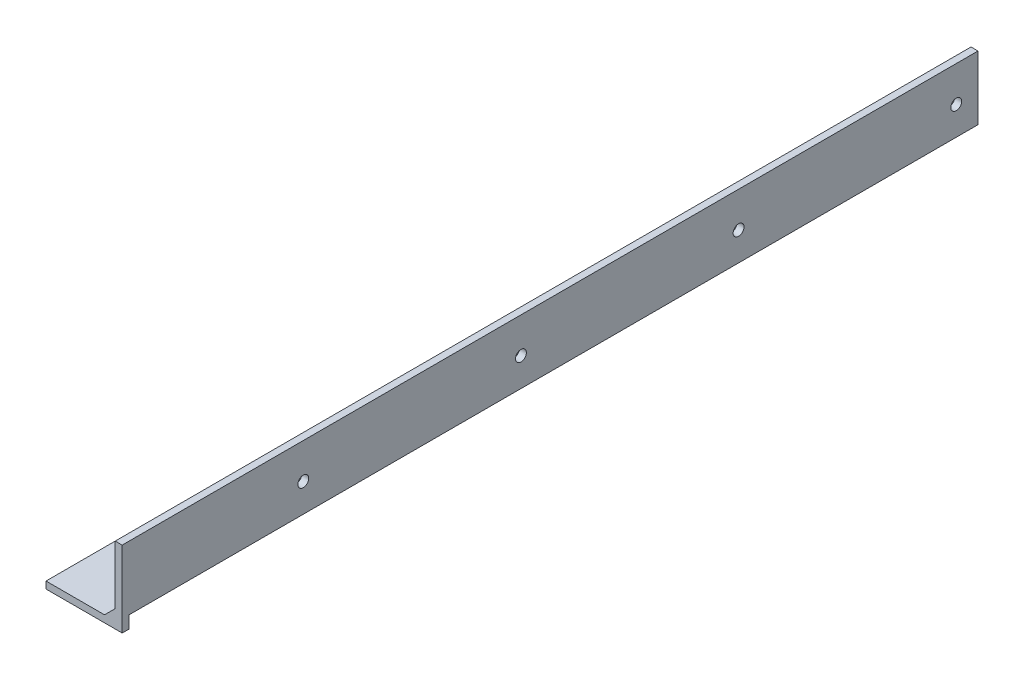
from build123d import *

# Parameters (mm, degrees)
BOSS_EXTRUDE1_DEPTH        = 247.65
F_1_8_0_1250_DOWEL_HOLE1_D = 3.175
F_1_8_0_1250_DOWEL_HOLE2_D = 3.175
BOSS_EXTRUDE2_DEPTH        = 2.032
CUT_EXTRUDE1_DEPTH         = 0.254
SKETCH10_W                 = 1.221153846
SKETCH10_H                 = 1.221153846
SKETCH10_W_2               = 6.35
CUT_EXTRUDE2_DEPTH         = 0.254


with BuildPart() as part:
    # Sketch1 → Boss-Extrude1 (new body)
    with BuildSketch(Plane.XY):
        Polygon((0, 3.592102448), (-3.592102448, 0), (-22.225, 0), (-22.225, 2.032), (-5.152204897, 2.032), (-2.032, 5.152204897), (-2.032, 22.225), (0, 22.225), align=None)
    extrude(amount=BOSS_EXTRUDE1_DEPTH)

    # 1/8 (0.1250) Dowel Hole1 (through all)
    with Locations(Plane.ZY.offset(2.032)):
        with Locations((196.85, 11.90625), (69.85, 11.90625), (133.35, 11.90625), (6.35, 11.90625)):
            Hole(F_1_8_0_1250_DOWEL_HOLE1_D / 2)

    # 1/8 (0.1250) Dowel Hole2 (through all)
    with Locations(Plane(origin=(0, 2.032, 0), x_dir=(1, 0, 0), z_dir=(0, 1, 0))):
        with Locations((-11.90625, -225.425), (-11.90625, -48.8188)):
            Hole(F_1_8_0_1250_DOWEL_HOLE2_D / 2)

    # Sketch6 → Boss-Extrude2 (add)
    with BuildSketch(Plane.XY.offset(247.65)):
        Polygon((-22.225, 0), (0, 0), (0, 22.225), (-2.032, 22.225), (-2.032, 5.152204897), (-5.152204897, 2.032), (-22.225, 2.032), align=None)
    extrude(amount=BOSS_EXTRUDE2_DEPTH)

    # Sketch7 → Cut-Extrude1 (cut)
    # profile 1 of 3: a face of its own
    with BuildSketch(Plane.ZY.offset(2.032)):
        Polygon((235.107067891, 9.543693468), (233.553149621, 9.543693468), (232.91051741, 11.302155006), (229.985853948, 11.302155006), (229.343221737, 9.543693468), (227.780144814, 9.543693468), (230.660541448, 17.163693468), (232.212933275, 17.163693468), align=None)
        Polygon((232.444952506, 12.572155006), (231.443606352, 15.307539622), (230.445313083, 12.572155006), align=None, mode=Mode.SUBTRACT)
    # profile 2 of 3: a face of its own
    with BuildSketch(Plane.ZY.offset(2.032)):
        Polygon((235.888606352, 9.543693468), (235.888606352, 17.163693468), (241.06629866, 17.163693468), (241.06629866, 15.893693468), (237.353990968, 15.893693468), (237.353990968, 14.037539622), (240.577837121, 14.037539622), (240.577837121, 12.767539622), (237.353990968, 12.767539622), (237.353990968, 9.543693468), align=None)
    # profile 3 of 3: a face of its own
    with BuildSketch(Plane.ZY.offset(2.032)):
        Polygon((244.094760198, 9.543693468), (244.094760198, 15.893693468), (241.847837121, 15.893693468), (241.847837121, 17.163693468), (247.807067891, 17.163693468), (247.807067891, 15.893693468), (245.560144814, 15.893693468), (245.560144814, 9.543693468), align=None)
    extrude(amount=-CUT_EXTRUDE1_DEPTH, mode=Mode.SUBTRACT)

    # Sketch10 → Cut-Extrude2 (cut)
    # profile 1 of 14: a face of its own
    with BuildSketch(Plane(origin=(0, 2.032, 0), x_dir=(1, 0, 0), z_dir=(0, 1, 0))):
        with BuildLine():
            Line((-22.225, -162.452538462), (-22.225, -161.231384615))
            Line((-22.225, -161.231384615), (-17.704186699, -161.231384615))
            add(Edge.make_bspline(
                [(-17.704186699, -161.231384615), (-17.760467017, -161.176113693), (-17.872490522, -161.066099347), (-18.026810892, -160.889326477), (-18.173015701, -160.708152688), (-18.304980132, -160.517277309), (-18.427828761, -160.320380437), (-18.537607096, -160.11492728), (-18.639868587, -159.904100466), (-18.696120115, -159.757955871), (-18.724358974, -159.684589744)],
                knots=[0, 0, 0, 0, 1.012608143, 2.015552075, 3.011331447, 4.000718745, 4.993456561, 5.989905615, 6.990911433, 8, 8, 8, 8], degree=3))
            Line((-18.724358974, -159.684589744), (-17.503205128, -159.684589744))
            add(Edge.make_bspline(
                [(-17.503205128, -159.684589744), (-17.472723103, -159.76592176), (-17.408926595, -159.936143344), (-17.272808222, -160.187509922), (-17.105370999, -160.450463464), (-16.940873501, -160.671089125), (-16.793259426, -160.84461008), (-16.675918268, -160.966795698), (-16.555215028, -161.079977408), (-16.427863096, -161.179994792), (-16.296338475, -161.269388031), (-16.160881812, -161.348598491), (-16.021058486, -161.418320822), (-15.923688863, -161.454820137), (-15.875, -161.473071314)],
                knots=[0, 0, 0, 0, 1.253621181, 2.623731602, 4.119264342, 5.756158754, 6.594718004, 7.409281336, 8.202581069, 8.983291728, 9.746205797, 10.498494251, 11.24918464, 12, 12, 12, 12], degree=3))
            Line((-15.875, -161.473071314), (-15.875, -162.452538462))
            Line((-15.875, -162.452538462), (-22.225, -162.452538462))
        make_face()
    # profile 2 of 14: a face of its own
    with BuildSketch(Plane(origin=(0, 2.032, 0), x_dir=(1, 0, 0), z_dir=(0, 1, 0))):
        with BuildLine():
            add(Edge.make_bspline(
                [(-18.772696314, -155.554291266), (-18.756229781, -155.51548151), (-18.723907996, -155.439302717), (-18.668025497, -155.331182341), (-18.606570465, -155.231708656), (-18.54156222, -155.139960121), (-18.473264366, -155.054873627), (-18.3979216, -154.980249153), (-18.318594746, -154.913689877), (-18.208571988, -154.835763139), (-18.062085357, -154.757192646), (-17.877170609, -154.687076), (-17.682722089, -154.645271262), (-17.550045494, -154.639882791), (-17.482852564, -154.637153846)],
                knots=[0, 0, 0, 0, 0.898362958, 1.763376344, 2.591090909, 3.388499105, 4.159186617, 4.913268308, 5.644585397, 6.364250201, 7.783723276, 9.173628931, 10.568608482, 12, 12, 12, 12], degree=3))
            add(Edge.make_bspline(
                [(-17.482852564, -154.637153846), (-17.425963476, -154.638595105), (-17.314252817, -154.641425244), (-17.150377774, -154.664461767), (-16.994122459, -154.704455906), (-16.845012656, -154.758735467), (-16.703963474, -154.829481864), (-16.570444775, -154.915566722), (-16.444558266, -155.017395028), (-16.327568202, -155.134851619), (-16.22063959, -155.265503915), (-16.126659362, -155.410109388), (-16.050308789, -155.569047714), (-15.983710126, -155.739433321), (-15.935708618, -155.924068606), (-15.899429889, -156.121252773), (-15.879848899, -156.331535255), (-15.876645522, -156.476056612), (-15.875, -156.550294872)],
                knots=[0, 0, 0, 0, 0.969511701, 1.903788506, 2.813616835, 3.714588001, 4.603504618, 5.497695013, 6.417687424, 7.358095086, 8.318756073, 9.291119523, 10.28995948, 11.319525871, 12.404821578, 13.536170001, 14.734370785, 16, 16, 16, 16], degree=3))
            add(Edge.make_bspline(
                [(-15.875, -156.550294872), (-15.876611492, -156.624114508), (-15.879738955, -156.767378103), (-15.899734047, -156.976320352), (-15.935226579, -157.171991444), (-15.9844813, -157.355827212), (-16.049959539, -157.526153397), (-16.126661824, -157.685408367), (-16.220974195, -157.830158965), (-16.327578267, -157.961822705), (-16.444096973, -158.080730741), (-16.570890691, -158.182233934), (-16.703538559, -158.270068551), (-16.845075716, -158.340463431), (-16.994090006, -158.394999861), (-17.150503903, -158.434429784), (-17.314127192, -158.459605396), (-17.425941566, -158.462143871), (-17.482852564, -158.463435897)],
                knots=[0, 0, 0, 0, 1.259437241, 2.444221022, 3.576496957, 4.648717845, 5.68588583, 6.685544666, 7.658705287, 8.625770615, 9.572078176, 10.492824823, 11.391686538, 12.281331915, 13.183041723, 14.093615956, 15.029693465, 16, 16, 16, 16], degree=3))
            add(Edge.make_bspline(
                [(-17.482852564, -158.463435897), (-17.553510095, -158.460650015), (-17.692550194, -158.455167946), (-17.894155951, -158.407354714), (-18.084578142, -158.332104896), (-18.25972055, -158.224038206), (-18.420120318, -158.090249134), (-18.559076521, -157.928593287), (-18.680748525, -157.744384264), (-18.741545031, -157.607521039), (-18.772696314, -157.537394231)],
                knots=[0, 0, 0, 0, 1.001685467, 1.971119642, 2.924446479, 3.896772127, 4.879289176, 5.877460772, 6.912440485, 8, 8, 8, 8], degree=3))
            add(Edge.make_bspline(
                [(-18.772696314, -157.537394231), (-18.790724634, -157.580927649), (-18.826100769, -157.666351255), (-18.889093703, -157.787720016), (-18.957982603, -157.900848523), (-19.031604253, -158.00757414), (-19.112972877, -158.105011373), (-19.200025897, -158.194376078), (-19.291985695, -158.276959664), (-19.390877734, -158.349729861), (-19.494230982, -158.415565933), (-19.6026342, -158.470470878), (-19.713503015, -158.520484549), (-19.829601245, -158.557218508), (-19.948645174, -158.588977636), (-20.072194643, -158.609508517), (-20.199536225, -158.62486496), (-20.285945212, -158.625788903), (-20.329667468, -158.62625641)],
                knots=[0, 0, 0, 0, 1.114377326, 2.186690884, 3.231000372, 4.246781561, 5.25120509, 6.230208897, 7.196590548, 8.171680384, 9.131898358, 10.092063928, 11.044441968, 12.005655067, 12.969168724, 13.957075074, 14.966296355, 16, 16, 16, 16], degree=3))
            add(Edge.make_bspline(
                [(-20.329667468, -158.62625641), (-20.400965586, -158.624444591), (-20.541056555, -158.620884615), (-20.74619236, -158.595929584), (-20.940647392, -158.550806914), (-21.12502405, -158.489406493), (-21.300029791, -158.412348612), (-21.464021084, -158.315898041), (-21.617504086, -158.202004347), (-21.759213797, -158.071301385), (-21.88807759, -157.92639951), (-22.000070379, -157.768451731), (-22.094740267, -157.599012053), (-22.17323724, -157.418595599), (-22.232079868, -157.225893977), (-22.275901998, -157.022165), (-22.301139434, -156.8070329), (-22.304630003, -156.659754499), (-22.306410256, -156.584639824)],
                knots=[0, 0, 0, 0, 1.069541455, 2.101501466, 3.093643398, 4.05914481, 5.013052617, 5.956704544, 6.907021547, 7.87488772, 8.843673124, 9.810849301, 10.773412862, 11.750618759, 12.756550522, 13.790782022, 14.873258462, 16, 16, 16, 16], degree=3))
            add(Edge.make_bspline(
                [(-22.306410256, -156.584639824), (-22.304783107, -156.514208814), (-22.30160032, -156.376442185), (-22.281372274, -156.173905453), (-22.245952461, -155.98076042), (-22.195798757, -155.796263316), (-22.133176123, -155.620180921), (-22.052859193, -155.454703384), (-21.962223385, -155.296186144), (-21.888996399, -155.199511315), (-21.85229367, -155.15105609)],
                knots=[0, 0, 0, 0, 1.102600357, 2.156742264, 3.182669202, 4.172953404, 5.147246686, 6.10327948, 7.049328352, 8, 8, 8, 8], degree=3))
            add(Edge.make_bspline(
                [(-21.85229367, -155.15105609), (-21.806993449, -155.096781417), (-21.717568333, -154.989640241), (-21.561986004, -154.853074493), (-21.396329277, -154.735039442), (-21.217542836, -154.639623207), (-21.02572574, -154.56518823), (-20.822142791, -154.512355471), (-20.60592301, -154.479415044), (-20.457840912, -154.476057153), (-20.381820913, -154.474333333)],
                knots=[0, 0, 0, 0, 1.009349607, 1.992511403, 2.949479119, 3.912246635, 4.881480856, 5.884237694, 6.913844069, 8, 8, 8, 8], degree=3))
            add(Edge.make_bspline(
                [(-20.381820913, -154.474333333), (-20.297633431, -154.477528968), (-20.131237104, -154.48384513), (-19.88706409, -154.533772), (-19.6536438, -154.615542249), (-19.46992111, -154.711185031), (-19.331175621, -154.803490951), (-19.232935371, -154.883230481), (-19.139449899, -154.970959473), (-19.053113177, -155.068979509), (-18.973774008, -155.177088446), (-18.90054607, -155.294359739), (-18.830935668, -155.419782773), (-18.792311256, -155.508988974), (-18.772696314, -155.554291266)],
                knots=[0, 0, 0, 0, 1.466938339, 2.899399569, 4.325666425, 5.767350359, 6.497299565, 7.228146711, 7.970752258, 8.730204686, 9.50204215, 10.306064764, 11.139755434, 12, 12, 12, 12], degree=3))
        make_face()
        with BuildLine():
            add(Edge.make_bspline(
                [(-17.578255208, -155.858307692), (-17.633168463, -155.860178441), (-17.738343358, -155.86376147), (-17.886454704, -155.899768616), (-18.01639996, -155.958933485), (-18.125345897, -156.042197287), (-18.211739175, -156.145477562), (-18.274264019, -156.265065096), (-18.310215678, -156.401124835), (-18.314876586, -156.496652192), (-18.317307692, -156.546478766)],
                knots=[0, 0, 0, 0, 1.153179909, 2.208675748, 3.182176805, 4.136412594, 5.066978114, 5.992358907, 6.952824812, 8, 8, 8, 8], degree=3))
            add(Edge.make_bspline(
                [(-18.317307692, -156.546478766), (-18.314978898, -156.596758835), (-18.310489005, -156.693698336), (-18.272857103, -156.831061164), (-18.210669869, -156.952913263), (-18.123168624, -157.056714259), (-18.01333727, -157.14054481), (-17.883627807, -157.200617767), (-17.734981168, -157.23702961), (-17.62978259, -157.240471383), (-17.574439103, -157.242282051)],
                knots=[0, 0, 0, 0, 1.048069097, 2.020667378, 2.946900928, 3.882892544, 4.829907216, 5.807806237, 6.846717784, 8, 8, 8, 8], degree=3))
            add(Edge.make_bspline(
                [(-17.574439103, -157.242282051), (-17.522039703, -157.240472948), (-17.421825288, -157.237013019), (-17.279925814, -157.199931568), (-17.154083209, -157.141285413), (-17.046041444, -157.058931114), (-16.958533632, -156.956841229), (-16.896933935, -156.836877294), (-16.858512951, -156.702297421), (-16.854180621, -156.607385149), (-16.851923077, -156.557927083)],
                knots=[0, 0, 0, 0, 1.119867523, 2.141758678, 3.116574366, 4.075485637, 5.028877949, 5.971135369, 6.942774029, 8, 8, 8, 8], degree=3))
            add(Edge.make_bspline(
                [(-16.851923077, -156.557927083), (-16.854192068, -156.50679238), (-16.858531813, -156.408990527), (-16.896457618, -156.270232902), (-16.959515793, -156.147739275), (-17.04850232, -156.044620235), (-17.156497151, -155.960678615), (-17.282524872, -155.900146318), (-17.425297923, -155.863818634), (-17.525879148, -155.860194764), (-17.578255208, -155.858307692)],
                knots=[0, 0, 0, 0, 1.078082589, 2.061974896, 3.011033917, 3.963675658, 4.914590949, 5.879605178, 6.895838403, 8, 8, 8, 8], degree=3))
        make_face(mode=Mode.SUBTRACT)
        with BuildLine():
            add(Edge.make_bspline(
                [(-20.266065705, -155.695487179), (-20.306790285, -155.696216957), (-20.385865857, -155.697633976), (-20.501292961, -155.708686071), (-20.609388118, -155.729898478), (-20.711781253, -155.755221589), (-20.806036556, -155.792091519), (-20.894816797, -155.833060044), (-20.975336311, -155.884870299), (-21.048637036, -155.943249934), (-21.115322943, -156.00658563), (-21.17212454, -156.075434712), (-21.221287752, -156.147087676), (-21.26122545, -156.222965743), (-21.29180939, -156.303326765), (-21.312706919, -156.38754254), (-21.328196303, -156.475105597), (-21.329050467, -156.534958146), (-21.329487179, -156.565559295)],
                knots=[0, 0, 0, 0, 1.266660568, 2.459495255, 3.600157037, 4.690936264, 5.734368452, 6.743052137, 7.727212053, 8.703476205, 9.654838001, 10.581848153, 11.474351395, 12.353305786, 13.242392268, 14.141206463, 15.049644211, 16, 16, 16, 16], degree=3))
            add(Edge.make_bspline(
                [(-21.329487179, -156.565559295), (-21.328893296, -156.595287311), (-21.327733593, -156.653338506), (-21.314500045, -156.73868516), (-21.292627963, -156.819893269), (-21.264039739, -156.898100467), (-21.224462367, -156.971043437), (-21.179502674, -157.041567435), (-21.123273901, -157.10671107), (-21.060586178, -157.168845013), (-20.989086119, -157.225061245), (-20.909612035, -157.273518527), (-20.82258645, -157.314451515), (-20.728051057, -157.346688269), (-20.626812359, -157.374654121), (-20.517468712, -157.390833285), (-20.401184231, -157.403249336), (-20.321225662, -157.404472701), (-20.280058093, -157.405102564)],
                knots=[0, 0, 0, 0, 0.94205482, 1.839591593, 2.729949169, 3.606493984, 4.472560757, 5.356396973, 6.253329276, 7.194616169, 8.152183414, 9.129927918, 10.140406247, 11.195006383, 12.29409547, 13.465637192, 14.695154768, 16, 16, 16, 16], degree=3))
            add(Edge.make_bspline(
                [(-20.280058093, -157.405102564), (-20.243984208, -157.40440601), (-20.173344008, -157.403042012), (-20.069988034, -157.391297189), (-19.971600145, -157.372530484), (-19.879066254, -157.345476673), (-19.791304774, -157.313311183), (-19.711135003, -157.269650547), (-19.633770724, -157.222533811), (-19.564876598, -157.164397032), (-19.500629555, -157.102975703), (-19.446181698, -157.034752232), (-19.398562316, -156.963646906), (-19.360102453, -156.888070032), (-19.331016537, -156.808473393), (-19.309081403, -156.725538245), (-19.296008828, -156.638058792), (-19.294832731, -156.578324559), (-19.294230769, -156.547750801)],
                knots=[0, 0, 0, 0, 1.180636308, 2.311932482, 3.400876688, 4.45529949, 5.465865804, 6.453091146, 7.438949275, 8.425393584, 9.397176442, 10.344561704, 11.27625781, 12.195041991, 13.112986908, 14.045613212, 14.999686698, 16, 16, 16, 16], degree=3))
            add(Edge.make_bspline(
                [(-19.294230769, -156.547750801), (-19.295262526, -156.512939473), (-19.297259362, -156.445566508), (-19.311097491, -156.347724753), (-19.335647014, -156.257013159), (-19.368164162, -156.172318445), (-19.412165973, -156.094938335), (-19.466170758, -156.024866423), (-19.528501343, -155.960636496), (-19.62428778, -155.887046647), (-19.753498749, -155.810802654), (-19.918344195, -155.743449535), (-20.090224832, -155.702508991), (-20.20733567, -155.697832432), (-20.266065705, -155.695487179)],
                knots=[0, 0, 0, 0, 0.864330177, 1.67280275, 2.446599708, 3.193426765, 3.919483654, 4.6480551, 5.385096832, 6.134886325, 7.640734944, 9.095289251, 10.543313583, 12, 12, 12, 12], degree=3))
        make_face(mode=Mode.SUBTRACT)
    # profile 3 of 14: a face of its own
    with BuildSketch(Plane(origin=(0, 2.032, 0), x_dir=(1, 0, 0), z_dir=(0, 1, 0))):
        with BuildLine():
            Line((-21.003846154, -153.741641026), (-22.225, -153.741641026))
            Line((-22.225, -153.741641026), (-22.225, -149.589717949))
            add(Edge.make_bspline(
                [(-22.225, -149.589717949), (-22.120643996, -149.603802658), (-21.911990501, -149.631964178), (-21.606883154, -149.718494313), (-21.309834433, -149.836126332), (-21.068337582, -149.962526395), (-20.871962394, -150.085436631), (-20.714066443, -150.201081048), (-20.54272239, -150.334619674), (-20.361935246, -150.490516186), (-20.168194375, -150.664881172), (-19.963207791, -150.85988331), (-19.74771743, -151.076137609), (-19.601399282, -151.228290449), (-19.525741186, -151.306965545)],
                knots=[0, 0, 0, 0, 1.156381417, 2.312114436, 3.475445649, 4.663832578, 5.302694182, 6.020660876, 6.814180865, 7.69035705, 8.644181007, 9.679458435, 10.800095821, 12, 12, 12, 12], degree=3))
            add(Edge.make_bspline(
                [(-19.525741186, -151.306965545), (-19.465150123, -151.369760054), (-19.349802586, -151.489302306), (-19.184452973, -151.659346511), (-19.03326529, -151.809252094), (-18.897200681, -151.939885999), (-18.777792343, -152.052987009), (-18.672275572, -152.145514651), (-18.582626678, -152.220354409), (-18.525711748, -152.260848868), (-18.500480769, -152.278800481)],
                knots=[0, 0, 0, 0, 1.480739016, 2.818890974, 4.024686436, 5.093297083, 6.019761393, 6.815071481, 7.474708909, 8, 8, 8, 8], degree=3))
            add(Edge.make_bspline(
                [(-18.500480769, -152.278800481), (-18.439477074, -152.315750445), (-18.321946728, -152.386938628), (-18.135847826, -152.46224373), (-17.951384801, -152.511393158), (-17.827441642, -152.517490154), (-17.766516426, -152.520487179)],
                knots=[0, 0, 0, 0, 1.091434863, 2.102769638, 3.067401785, 4, 4, 4, 4], degree=3))
            add(Edge.make_bspline(
                [(-17.766516426, -152.520487179), (-17.703140909, -152.518242702), (-17.583239374, -152.513996327), (-17.414499479, -152.477210754), (-17.268413639, -152.414802552), (-17.146706209, -152.325818662), (-17.050518904, -152.213747531), (-16.980571212, -152.081940385), (-16.941096094, -151.929935186), (-16.935997875, -151.823217447), (-16.933333333, -151.767442308)],
                knots=[0, 0, 0, 0, 1.192552326, 2.256215989, 3.232470907, 4.163657734, 5.069678789, 5.991331675, 6.950186205, 8, 8, 8, 8], degree=3))
            add(Edge.make_bspline(
                [(-16.933333333, -151.767442308), (-16.935842673, -151.712056102), (-16.940690174, -151.60506191), (-16.983037285, -151.452999948), (-17.056344587, -151.319973797), (-17.13988533, -151.225172287), (-17.221122635, -151.16112937), (-17.291915595, -151.11749276), (-17.372358106, -151.07988141), (-17.461544522, -151.046554615), (-17.560496567, -151.020230215), (-17.668460619, -150.999030178), (-17.786017681, -150.981946015), (-17.867798764, -150.97651295), (-17.91025641, -150.973692308)],
                knots=[0, 0, 0, 0, 1.402788338, 2.709884207, 3.961032948, 5.225417836, 5.883680772, 6.578928686, 7.329201998, 8.132101139, 8.990263233, 9.922304639, 10.921339128, 12, 12, 12, 12], degree=3))
            Line((-17.91025641, -150.973692308), (-17.790685096, -149.752538462))
            add(Edge.make_bspline(
                [(-17.790685096, -149.752538462), (-17.70824182, -149.762356349), (-17.548397479, -149.781391665), (-17.318805893, -149.828894615), (-17.106997291, -149.88905534), (-16.913364751, -149.964741906), (-16.736676959, -150.052826094), (-16.579585226, -150.157800932), (-16.440349418, -150.275998487), (-16.319043641, -150.407520909), (-16.215281989, -150.551532067), (-16.122658792, -150.702645936), (-16.046678327, -150.863815705), (-15.984059008, -151.033266888), (-15.934014149, -151.210922909), (-15.900925167, -151.397605449), (-15.877650249, -151.592162375), (-15.875896731, -151.724967744), (-15.875, -151.792883013)],
                knots=[0, 0, 0, 0, 1.270971563, 2.464210789, 3.586263665, 4.638946707, 5.643716971, 6.603612468, 7.52484387, 8.434700188, 9.336036235, 10.239171475, 11.145359471, 12.059630629, 13.003312604, 13.96741569, 14.960557767, 16, 16, 16, 16], degree=3))
            add(Edge.make_bspline(
                [(-15.875, -151.792883013), (-15.876418889, -151.86671578), (-15.879182353, -152.010514366), (-15.902007152, -152.220433169), (-15.941795487, -152.417642773), (-15.994533226, -152.603839928), (-16.064826512, -152.777209292), (-16.15037551, -152.939157298), (-16.252536703, -153.088038337), (-16.368470759, -153.224012921), (-16.494640096, -153.34605508), (-16.631347831, -153.45053978), (-16.773237701, -153.542270615), (-16.925086771, -153.614279132), (-17.083086009, -153.672946694), (-17.25002317, -153.710695639), (-17.423425554, -153.738299471), (-17.542097891, -153.740514856), (-17.602423878, -153.741641026)],
                knots=[0, 0, 0, 0, 1.21054264, 2.357683783, 3.456743179, 4.506371233, 5.526380269, 6.518616322, 7.504105716, 8.480749833, 9.444588379, 10.376395364, 11.298423092, 12.209585683, 13.126776925, 14.056012185, 15.011791738, 16, 16, 16, 16], degree=3))
            add(Edge.make_bspline(
                [(-17.602423878, -153.741641026), (-17.671640451, -153.740084562), (-17.808955511, -153.736996777), (-18.011971775, -153.707529958), (-18.210213478, -153.662288446), (-18.404773716, -153.596199426), (-18.598215612, -153.509380515), (-18.795308089, -153.403097159), (-18.995883137, -153.274363196), (-19.127332241, -153.176409706), (-19.195012019, -153.125975962)],
                knots=[0, 0, 0, 0, 0.953498, 1.891593709, 2.82157134, 3.753035249, 4.718494268, 5.740911752, 6.836853288, 8, 8, 8, 8], degree=3))
            add(Edge.make_bspline(
                [(-19.195012019, -153.125975962), (-19.219355078, -153.106679934), (-19.271492267, -153.065352316), (-19.350852826, -152.994831758), (-19.439544929, -152.914793291), (-19.533829603, -152.82156679), (-19.637781127, -152.718576205), (-19.747477635, -152.603092579), (-19.86486694, -152.476282631), (-19.987569279, -152.343242702), (-20.106585571, -152.208870322), (-20.219971899, -152.086021362), (-20.321904045, -151.975958045), (-20.413553907, -151.879743076), (-20.493155857, -151.795686537), (-20.562362842, -151.725391904), (-20.620135397, -151.667726744), (-20.710165402, -151.588248381), (-20.831938161, -151.487127685), (-20.948292948, -151.415983282), (-21.003846154, -151.382015625)],
                knots=[0, 0, 0, 0, 0.665546509, 1.425446362, 2.274432636, 3.225431318, 4.2662943, 5.410247296, 6.638261485, 7.969509561, 9.288545809, 10.484715594, 11.551975365, 12.503234464, 13.332293902, 14.032657109, 14.617374704, 15.080693821, 16.606187002, 18, 18, 18, 18], degree=3))
            Line((-21.003846154, -151.382015625), (-21.003846154, -153.741641026))
        make_face()
    # profile 4 of 14: a face of its own
    with BuildSketch(Plane(origin=(0, 2.032, 0), x_dir=(1, 0, 0), z_dir=(0, 1, 0))):
        with Locations((-21.614423077, -148.083628205)):
            Rectangle(SKETCH10_W, SKETCH10_H)
    # profile 5 of 14: a face of its own
    with BuildSketch(Plane(origin=(0, 2.032, 0), x_dir=(1, 0, 0), z_dir=(0, 1, 0))):
        with BuildLine():
            Line((-20.108333333, -138.843564103), (-20.026923077, -140.064717949))
            add(Edge.make_bspline(
                [(-20.026923077, -140.064717949), (-20.078009624, -140.074450271), (-20.177241992, -140.093354687), (-20.318698355, -140.135289511), (-20.45044033, -140.181683681), (-20.571858797, -140.236375448), (-20.682620243, -140.29901863), (-20.784545133, -140.367536895), (-20.874534831, -140.445278399), (-20.954525611, -140.5299346), (-21.023473816, -140.622474276), (-21.083563848, -140.722173089), (-21.134426732, -140.829623139), (-21.176756253, -140.944414069), (-21.208272876, -141.067689239), (-21.230717729, -141.198293778), (-21.245084801, -141.336438035), (-21.247063223, -141.43084771), (-21.248076923, -141.479221154)],
                knots=[0, 0, 0, 0, 1.20477517, 2.340199137, 3.415898527, 4.440826703, 5.422227366, 6.362763262, 7.28278988, 8.172822029, 9.057410505, 9.952475558, 10.866920142, 11.809098, 12.784128911, 13.811833846, 14.878831738, 16, 16, 16, 16], degree=3))
            add(Edge.make_bspline(
                [(-21.248076923, -141.479221154), (-21.247521431, -141.530137348), (-21.246440969, -141.629171968), (-21.233036895, -141.772684082), (-21.213834117, -141.906874427), (-21.183436569, -142.030558056), (-21.149441722, -142.146044642), (-21.10293315, -142.250465978), (-21.049292235, -142.345511851), (-20.988423695, -142.4309374), (-20.920916116, -142.505488357), (-20.850440394, -142.570709254), (-20.778519127, -142.627512347), (-20.701960764, -142.672220401), (-20.623861643, -142.70840203), (-20.54189193, -142.732315553), (-20.457933829, -142.748470554), (-20.400554189, -142.750323062), (-20.371644631, -142.75125641)],
                knots=[0, 0, 0, 0, 1.417779877, 2.757654889, 4.012140507, 5.189587551, 6.302846416, 7.360586765, 8.365575446, 9.33904572, 10.275781718, 11.161696098, 12.012180333, 12.822428111, 13.625933072, 14.403138519, 15.195454004, 16, 16, 16, 16], degree=3))
            add(Edge.make_bspline(
                [(-20.371644631, -142.75125641), (-20.335488577, -142.749387746), (-20.264887052, -142.745738826), (-20.16265131, -142.72179743), (-20.070182668, -142.67858883), (-19.983903337, -142.619936802), (-19.906783415, -142.537612875), (-19.8339681, -142.433446494), (-19.768624168, -142.303527311), (-19.732144953, -142.207206671), (-19.712730369, -142.15594391)],
                knots=[0, 0, 0, 0, 0.906150226, 1.7694295, 2.610923838, 3.450874087, 4.367551936, 5.419872502, 6.626831617, 8, 8, 8, 8], degree=3))
            add(Edge.make_bspline(
                [(-19.712730369, -142.15594391), (-19.705357487, -142.133946321), (-19.688858176, -142.084719288), (-19.665297103, -142.000734444), (-19.635586742, -141.899227137), (-19.60278376, -141.779253905), (-19.567813131, -141.641059449), (-19.52596757, -141.485956589), (-19.483921047, -141.311590035), (-19.452945627, -141.189587087), (-19.436698718, -141.125595353)],
                knots=[0, 0, 0, 0, 0.521824192, 1.167757792, 1.961731518, 2.901193269, 3.965386864, 5.168422915, 6.514810244, 8, 8, 8, 8], degree=3))
            add(Edge.make_bspline(
                [(-19.436698718, -141.125595353), (-19.415892081, -141.042261026), (-19.375749078, -140.881481069), (-19.304337521, -140.652172034), (-19.233386184, -140.440974219), (-19.156400177, -140.249921117), (-19.078597048, -140.076905333), (-18.994514501, -139.92472545), (-18.908519242, -139.790205806), (-18.844244285, -139.711818087), (-18.813401442, -139.674203125)],
                knots=[0, 0, 0, 0, 1.293880989, 2.496331788, 3.617634808, 4.64976062, 5.598842568, 6.473791081, 7.267636666, 8, 8, 8, 8], degree=3))
            add(Edge.make_bspline(
                [(-18.813401442, -139.674203125), (-18.769725642, -139.627555682), (-18.684095198, -139.536099057), (-18.543387942, -139.415710605), (-18.39475324, -139.314551523), (-18.239288213, -139.231286525), (-18.076097856, -139.16717405), (-17.906274497, -139.121731953), (-17.729374915, -139.092320177), (-17.608902109, -139.089318908), (-17.547726362, -139.087794872)],
                knots=[0, 0, 0, 0, 1.064429417, 2.086912298, 3.078678339, 4.055528992, 5.020032834, 5.993708893, 6.981211098, 8, 8, 8, 8], degree=3))
            add(Edge.make_bspline(
                [(-17.547726362, -139.087794872), (-17.468565998, -139.090763264), (-17.311535464, -139.096651669), (-17.080716312, -139.150641617), (-16.858016642, -139.234768892), (-16.681111052, -139.332256562), (-16.547449419, -139.426100195), (-16.450840427, -139.50373944), (-16.362457849, -139.59066976), (-16.27909278, -139.683769842), (-16.202525432, -139.784602354), (-16.133207804, -139.893291328), (-16.067011106, -140.007792971), (-15.991049858, -140.174876561), (-15.909912476, -140.400497577), (-15.841874119, -140.694090134), (-15.80121018, -141.013785802), (-15.796191223, -141.235713611), (-15.793589744, -141.350745593)],
                knots=[0, 0, 0, 0, 1.180224575, 2.341213254, 3.519178081, 4.726056898, 5.344182394, 5.956118988, 6.573855441, 7.192564044, 7.82049682, 8.461345463, 9.116141012, 9.79299132, 11.198532007, 12.687823846, 14.283197644, 16, 16, 16, 16], degree=3))
            add(Edge.make_bspline(
                [(-15.793589744, -141.350745593), (-15.794844489, -141.44493536), (-15.797284942, -141.628132443), (-15.822122955, -141.893676571), (-15.8603888, -142.141379534), (-15.916455826, -142.370835805), (-15.988788106, -142.582477419), (-16.076244285, -142.776716825), (-16.179617119, -142.95304362), (-16.299952176, -143.109583647), (-16.432597896, -143.249050211), (-16.577489606, -143.370711365), (-16.732792623, -143.475033815), (-16.898394707, -143.562690432), (-17.075146962, -143.631526962), (-17.262828926, -143.682084671), (-17.460998817, -143.71552398), (-17.596786807, -143.723905644), (-17.666025641, -143.728179487)],
                knots=[0, 0, 0, 0, 1.325136797, 2.577362738, 3.74962816, 4.849499017, 5.896771726, 6.892816139, 7.842473141, 8.766187929, 9.665133525, 10.546015357, 11.42313021, 12.293255665, 13.177485873, 14.086514152, 15.024305989, 16, 16, 16, 16], degree=3))
            Line((-17.666025641, -143.728179487), (-17.747435897, -142.507025641))
            add(Edge.make_bspline(
                [(-17.747435897, -142.507025641), (-17.709142164, -142.499983968), (-17.63451166, -142.486260479), (-17.527652568, -142.456370349), (-17.428721254, -142.422837477), (-17.338354998, -142.38304641), (-17.256426282, -142.337210005), (-17.182755701, -142.285113461), (-17.116787786, -142.227735677), (-17.060234456, -142.162657903), (-17.010028879, -142.091384402), (-16.96865854, -142.011206203), (-16.930797893, -141.924604099), (-16.902243242, -141.828331927), (-16.879620938, -141.724135707), (-16.862842308, -141.611985), (-16.854651777, -141.491638444), (-16.852853466, -141.408844821), (-16.851923077, -141.366010016)],
                knots=[0, 0, 0, 0, 1.150775252, 2.242741279, 3.277646382, 4.23752694, 5.158201782, 6.048759188, 6.901533576, 7.736611693, 8.592238639, 9.472855288, 10.399741491, 11.383322377, 12.435924598, 13.551250831, 14.733094547, 16, 16, 16, 16], degree=3))
            add(Edge.make_bspline(
                [(-16.851923077, -141.366010016), (-16.852744415, -141.321473483), (-16.854342366, -141.234825667), (-16.864148752, -141.108556705), (-16.882250397, -140.990106945), (-16.905814248, -140.878894646), (-16.937871238, -140.775068363), (-16.976959487, -140.6788472), (-17.022978388, -140.589790938), (-17.059184471, -140.535488312), (-17.077073317, -140.508658253)],
                knots=[0, 0, 0, 0, 1.186678824, 2.308736671, 3.37120409, 4.377216403, 5.334874112, 6.262130804, 7.141346615, 8, 8, 8, 8], degree=3))
            add(Edge.make_bspline(
                [(-17.077073317, -140.508658253), (-17.10150999, -140.477953503), (-17.14883624, -140.418487934), (-17.242810082, -140.354490397), (-17.348950718, -140.315963732), (-17.424009974, -140.311326611), (-17.4625, -140.308948718)],
                knots=[0, 0, 0, 0, 1.037857257, 2.010007357, 2.979541333, 4, 4, 4, 4], degree=3))
            add(Edge.make_bspline(
                [(-17.4625, -140.308948718), (-17.498471485, -140.310893401), (-17.569329585, -140.314724118), (-17.66998505, -140.353361829), (-17.763249578, -140.412781364), (-17.813912092, -140.468299174), (-17.840294471, -140.497209936)],
                knots=[0, 0, 0, 0, 0.98538058, 1.941042925, 2.927803204, 4, 4, 4, 4], degree=3))
            add(Edge.make_bspline(
                [(-17.840294471, -140.497209936), (-17.857417958, -140.520154351), (-17.895681825, -140.571425567), (-17.94431882, -140.665344274), (-17.996995624, -140.778706617), (-18.048493015, -140.914096984), (-18.099894814, -141.070615575), (-18.153564234, -141.248271907), (-18.207954216, -141.447175247), (-18.26062825, -141.662255646), (-18.3124038, -141.880622828), (-18.369009089, -142.089004613), (-18.424194868, -142.282769707), (-18.482038519, -142.461019675), (-18.538349135, -142.624673365), (-18.596184193, -142.772935803), (-18.652509068, -142.906825018), (-18.72995976, -143.062954686), (-18.834869853, -143.239911961), (-18.98737417, -143.425383148), (-19.158798983, -143.589408746), (-19.320440756, -143.703697423), (-19.459456982, -143.782207764), (-19.570269102, -143.832760139), (-19.687037134, -143.87649191), (-19.809890117, -143.912089452), (-19.939000919, -143.937889104), (-20.073383133, -143.959239818), (-20.214152833, -143.970148293), (-20.310147751, -143.971648154), (-20.358924279, -143.972410256)],
                knots=[0, 0, 0, 0, 0.511875881, 1.143829537, 1.88775736, 2.750598373, 3.734912702, 4.837306479, 6.073130119, 7.42648979, 8.801963576, 10.091065733, 11.292408984, 12.408830014, 13.446061236, 14.39066453, 15.257936293, 16.045629259, 17.510392066, 18.929669597, 20.331293837, 21.746891395, 22.460690638, 23.187651344, 23.925159671, 24.69163991, 25.474819891, 26.281170188, 27.126635539, 28, 28, 28, 28], degree=3))
            add(Edge.make_bspline(
                [(-20.358924279, -143.972410256), (-20.403907143, -143.971362341), (-20.493238752, -143.969281282), (-20.625829413, -143.954738279), (-20.75606551, -143.932247891), (-20.884110301, -143.898954382), (-21.009711935, -143.854787173), (-21.134683034, -143.805058305), (-21.256298834, -143.742875542), (-21.374657789, -143.672101636), (-21.489679662, -143.59404018), (-21.595759994, -143.505561991), (-21.696556502, -143.411954557), (-21.785771668, -143.3071471), (-21.872573821, -143.198668551), (-21.948226525, -143.079439133), (-22.017147788, -142.953273811), (-22.078597227, -142.819022596), (-22.131282147, -142.676240735), (-22.179028824, -142.525785934), (-22.217773302, -142.366238788), (-22.251051301, -142.198681728), (-22.276340342, -142.022464314), (-22.294002788, -141.837817456), (-22.303962163, -141.644696165), (-22.305584086, -141.513153182), (-22.306410256, -141.446148237)],
                knots=[0, 0, 0, 0, 0.900523777, 1.788352984, 2.667658312, 3.544829998, 4.433470602, 5.332071549, 6.235671317, 7.16456001, 8.092361829, 9.015217829, 9.927983376, 10.842405559, 11.767913001, 12.707486241, 13.664840466, 14.644960138, 15.660436429, 16.710285012, 17.80361473, 18.945755434, 20.129541241, 21.366238063, 22.658422763, 24, 24, 24, 24], degree=3))
            add(Edge.make_bspline(
                [(-22.306410256, -141.446148237), (-22.304830733, -141.349403421), (-22.301755362, -141.16103897), (-22.274228384, -140.887379246), (-22.232096344, -140.630704566), (-22.170948591, -140.391432664), (-22.092448514, -140.169271486), (-21.99575432, -139.964320976), (-21.880285857, -139.777577346), (-21.748852233, -139.606709998), (-21.599025812, -139.454060153), (-21.43403168, -139.316610377), (-21.251758418, -139.197021863), (-21.054548946, -139.092056253), (-20.839810238, -139.006401993), (-20.611084581, -138.933199265), (-20.365248779, -138.878736688), (-20.195452932, -138.855491068), (-20.108333333, -138.843564103)],
                knots=[0, 0, 0, 0, 1.217919187, 2.371317543, 3.459749122, 4.490553404, 5.476795534, 6.422548752, 7.338285933, 8.236452553, 9.131296239, 10.026155855, 10.935394819, 11.871650654, 12.834387429, 13.842485342, 14.893012909, 16, 16, 16, 16], degree=3))
        make_face()
    # profile 6 of 14: a face of its own
    with BuildSketch(Plane(origin=(0, 2.032, 0), x_dir=(1, 0, 0), z_dir=(0, 1, 0))):
        Polygon((-22.225, -133.307666667), (-15.875, -133.307666667), (-15.875, -138.029461538), (-16.933333333, -138.029461538), (-16.933333333, -134.528820513), (-18.317307692, -134.528820513), (-18.317307692, -137.785230769), (-19.375641026, -137.785230769), (-19.375641026, -134.528820513), (-21.166666667, -134.528820513), (-21.166666667, -138.110871795), (-22.225, -138.110871795), align=None)
    # profile 7 of 14: a face of its own
    with BuildSketch(Plane(origin=(0, 2.032, 0), x_dir=(1, 0, 0), z_dir=(0, 1, 0))):
        Polygon((-22.225, -127.934589744), (-15.875, -127.934589744), (-15.875, -129.15574359), (-21.166666667, -129.15574359), (-21.166666667, -132.412153846), (-22.225, -132.412153846), align=None)
    # profile 8 of 14: a face of its own
    with BuildSketch(Plane(origin=(0, 2.032, 0), x_dir=(1, 0, 0), z_dir=(0, 1, 0))):
        with BuildLine():
            add(Edge.make_bspline(
                [(-19.088161058, -120.851897436), (-19.009690378, -120.852346799), (-18.855584093, -120.853229291), (-18.629504388, -120.86852083), (-18.412798549, -120.88867627), (-18.20631896, -120.92149937), (-18.009099227, -120.96011132), (-17.82119789, -121.008404621), (-17.643273914, -121.066580948), (-17.529671379, -121.112860677), (-17.473948317, -121.135561298)],
                knots=[0, 0, 0, 0, 1.141009212, 2.240794809, 3.294380675, 4.305229195, 5.280013876, 6.216333343, 7.125095522, 8, 8, 8, 8], degree=3))
            add(Edge.make_bspline(
                [(-17.473948317, -121.135561298), (-17.394731531, -121.172668199), (-17.237229677, -121.246445563), (-17.014666896, -121.383461724), (-16.80477216, -121.538761464), (-16.608645824, -121.711066243), (-16.42924046, -121.895977065), (-16.275695301, -122.094366253), (-16.1428248, -122.299185636), (-16.075998835, -122.444858716), (-16.042908654, -122.516991587)],
                knots=[0, 0, 0, 0, 1.031372299, 2.050613973, 3.077158538, 4.108712802, 5.127684358, 6.111366908, 7.06480644, 8, 8, 8, 8], degree=3))
            add(Edge.make_bspline(
                [(-16.042908654, -122.516991587), (-16.022824909, -122.565955109), (-15.982230541, -122.664922872), (-15.931566643, -122.818730426), (-15.890404515, -122.978373873), (-15.853610369, -123.142698522), (-15.828239594, -123.31329983), (-15.806967072, -123.488799265), (-15.795817773, -123.670157278), (-15.794340497, -123.792830137), (-15.793589744, -123.855172676)],
                knots=[0, 0, 0, 0, 0.92659354, 1.872881803, 2.832850937, 3.813025581, 4.820167273, 5.851730198, 6.908245912, 8, 8, 8, 8], degree=3))
            add(Edge.make_bspline(
                [(-15.793589744, -123.855172676), (-15.796387917, -123.966801825), (-15.801863981, -124.185261605), (-15.841417014, -124.504369926), (-15.908205757, -124.806343548), (-16.00474091, -125.090159075), (-16.125409639, -125.358267855), (-16.275093935, -125.608570822), (-16.452135599, -125.84149823), (-16.654250977, -126.056374287), (-16.880360364, -126.250393937), (-17.130717014, -126.417028146), (-17.399934644, -126.560654154), (-17.691496756, -126.67648139), (-18.003757235, -126.766823089), (-18.33741414, -126.828794254), (-18.691106772, -126.869968606), (-18.934121844, -126.874123151), (-19.058904247, -126.87625641)],
                knots=[0, 0, 0, 0, 1.064687426, 2.083607927, 3.061933343, 4.009715682, 4.938290439, 5.861555806, 6.785379163, 7.723907601, 8.670645075, 9.620815051, 10.587025556, 11.576201955, 12.607926824, 13.682791464, 14.810169074, 16, 16, 16, 16], degree=3))
            add(Edge.make_bspline(
                [(-19.058904247, -126.87625641), (-19.182825304, -126.873978192), (-19.424076449, -126.869542928), (-19.775383237, -126.830398536), (-20.106148216, -126.768396262), (-20.415618407, -126.676704106), (-20.70614604, -126.563668114), (-20.974303585, -126.420762988), (-21.223528321, -126.255580361), (-21.448223518, -126.06227889), (-21.650589846, -125.849655512), (-21.825613596, -125.617243224), (-21.976157388, -125.369560955), (-22.097088565, -125.102786062), (-22.191183133, -124.819162856), (-22.258611992, -124.518831253), (-22.298174367, -124.201375795), (-22.303621352, -123.98418484), (-22.306410256, -123.87298117)],
                knots=[0, 0, 0, 0, 1.188503542, 2.313794348, 3.386815875, 4.412724616, 5.406050757, 6.372287373, 7.322246111, 8.268662201, 9.209598637, 10.133005659, 11.054574072, 11.984756797, 12.936664457, 13.916615443, 14.933288873, 16, 16, 16, 16], degree=3))
            add(Edge.make_bspline(
                [(-22.306410256, -123.87298117), (-22.303589858, -123.760510835), (-22.298069528, -123.540374077), (-22.258864019, -123.219063608), (-22.191183185, -122.915385157), (-22.097200192, -122.629779264), (-21.977031259, -122.361097712), (-21.829122239, -122.110894444), (-21.652953076, -121.879007052), (-21.452178093, -121.66583442), (-21.228642393, -121.472592279), (-20.980948391, -121.307714782), (-20.715429675, -121.164782813), (-20.428066374, -121.051157963), (-20.121814512, -120.959969211), (-19.794912052, -120.897815864), (-19.448258672, -120.858595657), (-19.210387555, -120.854170986), (-19.088161058, -120.851897436)],
                knots=[0, 0, 0, 0, 1.080868081, 2.11556935, 3.105256676, 4.066632898, 5.000538419, 5.928691231, 6.853779256, 7.79363201, 8.738674366, 9.686979733, 10.647777075, 11.631556772, 12.651514868, 13.714488213, 14.825624133, 16, 16, 16, 16], degree=3))
        make_face()
        with BuildLine():
            add(Edge.make_bspline(
                [(-19.046183894, -122.073051282), (-19.134021602, -122.074270306), (-19.304117653, -122.076630922), (-19.551000872, -122.101805178), (-19.781828032, -122.139948356), (-19.996219777, -122.196251684), (-20.194910626, -122.266753431), (-20.376460246, -122.35554988), (-20.543345343, -122.457717726), (-20.690497838, -122.578660259), (-20.822035359, -122.709287756), (-20.935279578, -122.850277073), (-21.03398287, -122.998156716), (-21.1108312, -123.157182053), (-21.172242661, -123.323307121), (-21.217699819, -123.49779931), (-21.242677397, -123.681445894), (-21.246257775, -123.806764279), (-21.248076923, -123.870437099)],
                knots=[0, 0, 0, 0, 1.313760844, 2.544072881, 3.709057706, 4.810798106, 5.856328071, 6.8578978, 7.829608234, 8.776800457, 9.700893773, 10.598542645, 11.478326183, 12.355016441, 13.234159304, 14.125057487, 15.047363429, 16, 16, 16, 16], degree=3))
            add(Edge.make_bspline(
                [(-21.248076923, -123.870437099), (-21.24629424, -123.934118236), (-21.242785631, -124.05945299), (-21.217303189, -124.242877641), (-21.17377453, -124.417702088), (-21.112753432, -124.583216445), (-21.034239655, -124.7401754), (-20.938540448, -124.88844113), (-20.824287569, -125.02716323), (-20.694744999, -125.157717049), (-20.546549667, -125.275305728), (-20.380028273, -125.376815121), (-20.197008363, -125.464254054), (-19.995908887, -125.532719431), (-19.779032422, -125.590122658), (-19.54362819, -125.625999059), (-19.291827404, -125.651586399), (-19.117914322, -125.653907532), (-19.028375401, -125.655102564)],
                knots=[0, 0, 0, 0, 0.949185128, 1.868149516, 2.754265681, 3.630223372, 4.492411659, 5.365559627, 6.255051142, 7.166857153, 8.10270998, 9.067572068, 10.068471475, 11.120005306, 12.229988237, 13.408413857, 14.665725295, 16, 16, 16, 16], degree=3))
            add(Edge.make_bspline(
                [(-19.028375401, -125.655102564), (-18.939705921, -125.653733457), (-18.767989049, -125.651082051), (-18.51930047, -125.628019584), (-18.287959625, -125.59018282), (-18.073910801, -125.537796442), (-17.877683383, -125.467914119), (-17.697191896, -125.386864838), (-17.535455064, -125.286250488), (-17.391263305, -125.171293609), (-17.26370422, -125.044062358), (-17.153975796, -124.905693876), (-17.059745705, -124.75817029), (-16.983518903, -124.60014931), (-16.92450784, -124.43153394), (-16.883200006, -124.253227811), (-16.856976722, -124.064982368), (-16.853632613, -123.93624745), (-16.851923077, -123.870437099)],
                knots=[0, 0, 0, 0, 1.332102096, 2.579742291, 3.748638211, 4.851919079, 5.885623862, 6.874802917, 7.818925756, 8.739297243, 9.640302518, 10.519879355, 11.387702267, 12.265338757, 13.149908458, 14.066302139, 15.011477716, 16, 16, 16, 16], degree=3))
            add(Edge.make_bspline(
                [(-16.851923077, -123.870437099), (-16.853628565, -123.804625601), (-16.856964755, -123.67588844), (-16.88324486, -123.487659096), (-16.924469181, -123.30876674), (-16.984547639, -123.139697933), (-17.062657554, -122.98116089), (-17.157765699, -122.832610016), (-17.268796462, -122.692976477), (-17.397662335, -122.56457824), (-17.543172548, -122.447720869), (-17.707225809, -122.347402587), (-17.888039351, -122.261860014), (-18.086145888, -122.19167707), (-18.302091115, -122.139649866), (-18.534423543, -122.099662611), (-18.784549442, -122.077207256), (-18.957098002, -122.074466381), (-19.046183894, -122.073051282)],
                knots=[0, 0, 0, 0, 0.981979984, 1.920900141, 2.831228887, 3.718021039, 4.592624278, 5.463440991, 6.346090553, 7.250083161, 8.173257457, 9.125226447, 10.113224917, 11.154132427, 12.2562525, 13.424702564, 14.670387795, 16, 16, 16, 16], degree=3))
        make_face(mode=Mode.SUBTRACT)
    # profile 9 of 14: a face of its own
    with BuildSketch(Plane(origin=(0, 2.032, 0), x_dir=(1, 0, 0), z_dir=(0, 1, 0))):
        Polygon((-22.225, -114.746128205), (-15.875, -114.746128205), (-15.875, -115.967282051), (-18.398717949, -115.967282051), (-18.398717949, -118.572410256), (-15.875, -118.572410256), (-15.875, -119.793564103), (-22.225, -119.793564103), (-22.225, -118.572410256), (-19.457051282, -118.572410256), (-19.457051282, -115.967282051), (-22.225, -115.967282051), align=None)
    # profile 10 of 14: a face of its own
    with BuildSketch(Plane(origin=(0, 2.032, 0), x_dir=(1, 0, 0), z_dir=(0, 1, 0))):
        Polygon((-22.225, -106.93074359), (-15.875, -106.93074359), (-15.875, -108.151897436), (-21.166666667, -108.151897436), (-21.166666667, -111.408307692), (-22.225, -111.408307692), align=None)
    # profile 11 of 14: a face of its own
    with BuildSketch(Plane(origin=(0, 2.032, 0), x_dir=(1, 0, 0), z_dir=(0, 1, 0))):
        Polygon((-22.225, -101.557666667), (-15.875, -101.557666667), (-15.875, -102.778820513), (-21.166666667, -102.778820513), (-21.166666667, -106.035230769), (-22.225, -106.035230769), align=None)
    # profile 12 of 14: a face of its own
    with BuildSketch(Plane(origin=(0, 2.032, 0), x_dir=(1, 0, 0), z_dir=(0, 1, 0))):
        with Locations((-19.05, -99.644525641)):
            Rectangle(SKETCH10_W_2, SKETCH10_H)
    # profile 13 of 14: a face of its own
    with BuildSketch(Plane(origin=(0, 2.032, 0), x_dir=(1, 0, 0), z_dir=(0, 1, 0))):
        with BuildLine():
            Line((-22.225, -92.765358974), (-15.875, -92.765358974))
            Line((-15.875, -92.765358974), (-15.875, -95.430272837))
            add(Edge.make_bspline(
                [(-15.875, -95.430272837), (-15.87549942, -95.511262147), (-15.876461893, -95.66734337), (-15.88347266, -95.893068174), (-15.89818138, -96.101233891), (-15.914782387, -96.292778103), (-15.939193108, -96.467147374), (-15.96785509, -96.624760824), (-16.001729163, -96.76511011), (-16.041610398, -96.889743013), (-16.088331997, -97.002942314), (-16.142810953, -97.108762605), (-16.207125487, -97.208203948), (-16.278574399, -97.302569993), (-16.357348929, -97.392227057), (-16.445511827, -97.47472613), (-16.541756258, -97.551502126), (-16.645279836, -97.622493762), (-16.75562589, -97.685032912), (-16.869250508, -97.742177287), (-16.987362861, -97.788694961), (-17.109406543, -97.827118138), (-17.235116583, -97.857811164), (-17.364812582, -97.879114717), (-17.498259785, -97.892414296), (-17.588399501, -97.893601551), (-17.63422476, -97.894205128)],
                knots=[0, 0, 0, 0, 1.675792322, 3.229558513, 4.671612708, 5.993327294, 7.206773438, 8.313218507, 9.306927966, 10.191988363, 11.018030861, 11.838135071, 12.650980327, 13.465150207, 14.285535933, 15.117196726, 15.959844754, 16.83101188, 17.711363548, 18.582398133, 19.460517458, 20.334551361, 21.228266118, 22.135486512, 23.052118027, 24, 24, 24, 24], degree=3))
            add(Edge.make_bspline(
                [(-17.63422476, -97.894205128), (-17.691956134, -97.893099466), (-17.80477915, -97.890938698), (-17.970068743, -97.870609898), (-18.12838937, -97.841390012), (-18.278379452, -97.796220457), (-18.421167267, -97.740057359), (-18.55574958, -97.671439311), (-18.683388408, -97.590458586), (-18.802279097, -97.496698448), (-18.912661107, -97.390535117), (-19.012122594, -97.271369634), (-19.101703077, -97.139989495), (-19.178723195, -96.995319492), (-19.246599448, -96.839853454), (-19.302366989, -96.671543683), (-19.348205706, -96.491258604), (-19.369718772, -96.365817689), (-19.380729167, -96.301616987)],
                knots=[0, 0, 0, 0, 1.059179627, 2.069928931, 3.052909591, 4.01082991, 4.940120368, 5.865982481, 6.779263376, 7.710344595, 8.640547144, 9.585223395, 10.554458868, 11.553878165, 12.589111246, 13.664634927, 14.804759383, 16, 16, 16, 16], degree=3))
            add(Edge.make_bspline(
                [(-19.380729167, -96.301616987), (-19.421749267, -96.363785485), (-19.501847942, -96.485179975), (-19.635750266, -96.652161664), (-19.773493434, -96.804299168), (-19.89774551, -96.918513603), (-20.006496218, -97.006362569), (-20.101658372, -97.077055979), (-20.211160879, -97.153323183), (-20.335081196, -97.234399995), (-20.472317199, -97.322688402), (-20.624971287, -97.414903215), (-20.791553899, -97.512974653), (-20.907920313, -97.578912129), (-20.968229167, -97.613085337)],
                knots=[0, 0, 0, 0, 1.285482994, 2.510122655, 3.691653098, 4.826411195, 5.419869803, 6.105175889, 6.872935239, 7.723789235, 8.662129684, 9.690525463, 10.803075916, 12, 12, 12, 12], degree=3))
            Line((-20.968229167, -97.613085337), (-22.225, -98.382666667))
            Line((-22.225, -98.382666667), (-22.225, -96.955443109))
            Line((-22.225, -96.955443109), (-20.783784054, -96.052298077))
            add(Edge.make_bspline(
                [(-20.783784054, -96.052298077), (-20.726053562, -96.010834428), (-20.615834183, -95.931671798), (-20.459377973, -95.817174101), (-20.319321337, -95.71302446), (-20.196520442, -95.61910311), (-20.089697097, -95.536550972), (-20.00152085, -95.462544045), (-19.927761785, -95.400712218), (-19.854709329, -95.330643217), (-19.779536471, -95.249195541), (-19.707188848, -95.148473286), (-19.648411531, -95.045722426), (-19.604268074, -94.934568551), (-19.57374091, -94.805717289), (-19.553832613, -94.651034687), (-19.539376791, -94.46591281), (-19.538782088, -94.332117298), (-19.538461538, -94.260000401)],
                knots=[0, 0, 0, 0, 1.465382114, 2.797715724, 3.99708711, 5.063614826, 5.985194575, 6.779875669, 7.43696127, 7.968700361, 8.866038685, 9.717629234, 10.520014012, 11.30082289, 12.174340694, 13.242479345, 14.513673363, 16, 16, 16, 16], degree=3))
            Line((-19.538461538, -94.260000401), (-19.538461538, -93.986512821))
            Line((-19.538461538, -93.986512821), (-22.225, -93.986512821))
            Line((-22.225, -93.986512821), (-22.225, -92.765358974))
        make_face()
        with BuildLine():
            Line((-18.480128205, -93.986512821), (-18.480128205, -94.969796074))
            add(Edge.make_bspline(
                [(-18.480128205, -94.969796074), (-18.479967121, -95.045697936), (-18.479660229, -95.190303809), (-18.475151304, -95.395934783), (-18.471414536, -95.579214054), (-18.461667485, -95.7398688), (-18.452370506, -95.878234154), (-18.439961846, -95.994135663), (-18.425394884, -96.087723736), (-18.402735173, -96.181201213), (-18.363259619, -96.276957843), (-18.307027805, -96.379000336), (-18.234101704, -96.466268713), (-18.149714531, -96.541658962), (-18.05093944, -96.599853543), (-17.940615735, -96.642531902), (-17.81897096, -96.668018957), (-17.73399025, -96.671339827), (-17.690194311, -96.673051282)],
                knots=[0, 0, 0, 0, 1.698120923, 3.235207303, 4.601799022, 5.7989489, 6.835765357, 7.704239165, 8.40605236, 8.953649664, 9.852072573, 10.714567413, 11.550246753, 12.383769498, 13.234656382, 14.099651817, 15.020630301, 16, 16, 16, 16], degree=3))
            add(Edge.make_bspline(
                [(-17.690194311, -96.673051282), (-17.641233517, -96.670925572), (-17.54677156, -96.666824356), (-17.412824195, -96.633454796), (-17.293414042, -96.577908304), (-17.190631848, -96.498601952), (-17.102940295, -96.399549937), (-17.034555454, -96.280650502), (-16.982592048, -96.14447433), (-16.963607335, -96.046341069), (-16.953685897, -95.99505649)],
                knots=[0, 0, 0, 0, 1.062451802, 2.049829439, 2.976851779, 3.903462222, 4.849641532, 5.832195941, 6.867102576, 8, 8, 8, 8], degree=3))
            add(Edge.make_bspline(
                [(-16.953685897, -95.99505649), (-16.951823733, -95.978109005), (-16.947410012, -95.937939907), (-16.944575273, -95.867006041), (-16.940217971, -95.776307993), (-16.938437238, -95.664747954), (-16.935315772, -95.533322595), (-16.934742591, -95.38150931), (-16.932911321, -95.209790421), (-16.933187514, -95.088520099), (-16.933333333, -95.02449359)],
                knots=[0, 0, 0, 0, 0.42127143, 0.998501726, 1.753681744, 2.66564073, 3.755712164, 5.002818897, 6.417592707, 8, 8, 8, 8], degree=3))
            Line((-16.933333333, -95.02449359), (-16.933333333, -93.986512821))
            Line((-16.933333333, -93.986512821), (-18.480128205, -93.986512821))
        make_face(mode=Mode.SUBTRACT)
    # profile 14 of 14: a face of its own
    with BuildSketch(Plane(origin=(0, 2.032, 0), x_dir=(1, 0, 0), z_dir=(0, 1, 0))):
        with BuildLine():
            Line((-15.875, -86.415358974), (-15.875, -88.744455529))
            add(Edge.make_bspline(
                [(-15.875, -88.744455529), (-15.874967023, -88.808066937), (-15.87490281, -88.931933125), (-15.882360333, -89.111695393), (-15.88986162, -89.279796224), (-15.904877557, -89.435753128), (-15.920616922, -89.580107166), (-15.940544142, -89.713117378), (-15.966083055, -89.83394353), (-15.986223543, -89.910136433), (-15.995843349, -89.946528846)],
                knots=[0, 0, 0, 0, 1.259756885, 2.453039283, 3.563158368, 4.591894114, 5.55549294, 6.43918076, 7.254497783, 8, 8, 8, 8], degree=3))
            add(Edge.make_bspline(
                [(-15.995843349, -89.946528846), (-16.010652987, -89.992051848), (-16.040005507, -90.082277875), (-16.091993388, -90.214694759), (-16.154653393, -90.340640018), (-16.223538943, -90.463034112), (-16.301061325, -90.579062998), (-16.385566919, -90.691551217), (-16.479817037, -90.797171214), (-16.613929313, -90.933916324), (-16.800778245, -91.08901434), (-17.047368717, -91.253038241), (-17.319023937, -91.391072672), (-17.561499011, -91.48753789), (-17.768325971, -91.551317917), (-17.933958272, -91.593027269), (-18.108287296, -91.629042393), (-18.291913264, -91.656031005), (-18.483993323, -91.679280811), (-18.685093808, -91.695966502), (-18.895166195, -91.704227774), (-19.038121849, -91.706080422), (-19.111057692, -91.707025641)],
                knots=[0, 0, 0, 0, 0.745431882, 1.477436776, 2.212739876, 2.934276521, 3.663147754, 4.384200836, 5.123377481, 5.865761747, 7.365547505, 8.894711587, 10.468722596, 12.101948761, 12.951987285, 13.837595333, 14.760899389, 15.722756883, 16.726861385, 17.773652936, 18.864119771, 20, 20, 20, 20], degree=3))
            add(Edge.make_bspline(
                [(-19.111057692, -91.707025641), (-19.237081159, -91.704540221), (-19.480751791, -91.699734577), (-19.832964856, -91.66419127), (-20.159060141, -91.605165246), (-20.363206278, -91.543504036), (-20.461959135, -91.513676282)],
                knots=[0, 0, 0, 0, 1.103491527, 2.133638164, 3.0971734, 4, 4, 4, 4], degree=3))
            add(Edge.make_bspline(
                [(-20.461959135, -91.513676282), (-20.51859321, -91.493523641), (-20.630001273, -91.453880252), (-20.790707949, -91.384507293), (-20.943644121, -91.309549321), (-21.088689293, -91.22838459), (-21.225191049, -91.140603032), (-21.352741103, -91.045876313), (-21.47301869, -90.94567277), (-21.547050115, -90.873081101), (-21.583894231, -90.836953526)],
                knots=[0, 0, 0, 0, 1.090884612, 2.145940218, 3.175104604, 4.181306866, 5.161203701, 6.118658341, 7.063689906, 8, 8, 8, 8], degree=3))
            add(Edge.make_bspline(
                [(-21.583894231, -90.836953526), (-21.636356937, -90.77798569), (-21.744077376, -90.656908423), (-21.879894876, -90.445126279), (-21.996949299, -90.204617956), (-22.05838129, -90.031174747), (-22.090164263, -89.941440705)],
                knots=[0, 0, 0, 0, 0.912008655, 1.872605891, 2.89935344, 4, 4, 4, 4], degree=3))
            add(Edge.make_bspline(
                [(-22.090164263, -89.941440705), (-22.101319779, -89.905118873), (-22.124472476, -89.82973479), (-22.149200035, -89.710205892), (-22.175250764, -89.582605796), (-22.190944124, -89.445463094), (-22.207493467, -89.300201394), (-22.216784998, -89.145663095), (-22.223381446, -88.982383899), (-22.224452482, -88.870394702), (-22.225, -88.813145433)],
                knots=[0, 0, 0, 0, 0.799129865, 1.658552685, 2.566799617, 3.538529252, 4.561352959, 5.643373779, 6.795284424, 8, 8, 8, 8], degree=3))
            Line((-22.225, -88.813145433), (-22.225, -86.415358974))
            Line((-22.225, -86.415358974), (-15.875, -86.415358974))
        make_face()
        with BuildLine():
            Line((-16.933333333, -87.636512821), (-21.166666667, -87.636512821))
            Line((-21.166666667, -87.636512821), (-21.166666667, -88.641420673))
            add(Edge.make_bspline(
                [(-21.166666667, -88.641420673), (-21.16630686, -88.686789628), (-21.165614094, -88.774142198), (-21.163578487, -88.900543604), (-21.158067711, -89.016705434), (-21.152359445, -89.123236212), (-21.142928392, -89.219858599), (-21.133652591, -89.306993014), (-21.12067594, -89.384154425), (-21.110432343, -89.431811208), (-21.105608974, -89.454251202)],
                knots=[0, 0, 0, 0, 1.333384787, 2.567275092, 3.714769766, 4.750907381, 5.701951617, 6.567520054, 7.325492842, 8, 8, 8, 8], degree=3))
            add(Edge.make_bspline(
                [(-21.105608974, -89.454251202), (-21.091584157, -89.506808212), (-21.064267512, -89.609175404), (-21.003370848, -89.752909291), (-20.929905685, -89.882969941), (-20.841566985, -90.001535471), (-20.729927301, -90.108387557), (-20.587148898, -90.199598874), (-20.41686551, -90.284012544), (-20.253861722, -90.341819045), (-20.108270552, -90.383312441), (-19.986072289, -90.411400066), (-19.853866125, -90.433596956), (-19.712173831, -90.452689177), (-19.561177614, -90.468116146), (-19.400332204, -90.477715535), (-19.22983449, -90.484267178), (-19.112760399, -90.48532679), (-19.052544071, -90.485871795)],
                knots=[0, 0, 0, 0, 1.038686998, 2.023088296, 2.974059649, 3.888265163, 4.839857954, 5.909819677, 7.113156087, 8.466843969, 9.20827164, 10.006482943, 10.861893492, 11.769681931, 12.739021491, 13.762258324, 14.849031541, 16, 16, 16, 16], degree=3))
            add(Edge.make_bspline(
                [(-19.052544071, -90.485871795), (-18.992327555, -90.485330985), (-18.875676821, -90.484283333), (-18.706450444, -90.477741695), (-18.548137814, -90.468196379), (-18.400543727, -90.452659025), (-18.263462525, -90.433864514), (-18.136783802, -90.411401802), (-18.021320292, -90.383502876), (-17.884208052, -90.341890765), (-17.729532126, -90.279422734), (-17.562231765, -90.191626345), (-17.417321654, -90.08834231), (-17.293021206, -89.971787069), (-17.190223622, -89.837884547), (-17.104220122, -89.689479959), (-17.037442668, -89.523548687), (-17.009003689, -89.405508295), (-16.994391026, -89.34485617)],
                knots=[0, 0, 0, 0, 1.118059345, 2.165891593, 3.144157881, 4.062285166, 4.920717571, 5.712910489, 6.449981617, 7.12489426, 8.371943983, 9.541298068, 10.624898781, 11.666293176, 12.69306237, 13.747704633, 14.842713931, 16, 16, 16, 16], degree=3))
            add(Edge.make_bspline(
                [(-16.994391026, -89.34485617), (-16.989512518, -89.318603302), (-16.978771913, -89.260804536), (-16.966234884, -89.164892489), (-16.956856429, -89.051947526), (-16.947518355, -88.922223775), (-16.941940305, -88.775856603), (-16.936342613, -88.612626637), (-16.934393829, -88.432386455), (-16.93369699, -88.306450997), (-16.933333333, -88.240729567)],
                knots=[0, 0, 0, 0, 0.578739524, 1.274162912, 2.095457587, 3.035141998, 4.093102578, 5.270121571, 6.575369351, 8, 8, 8, 8], degree=3))
            Line((-16.933333333, -88.240729567), (-16.933333333, -87.636512821))
        make_face(mode=Mode.SUBTRACT)
    extrude(amount=-CUT_EXTRUDE2_DEPTH, mode=Mode.SUBTRACT)


solid = part.part
